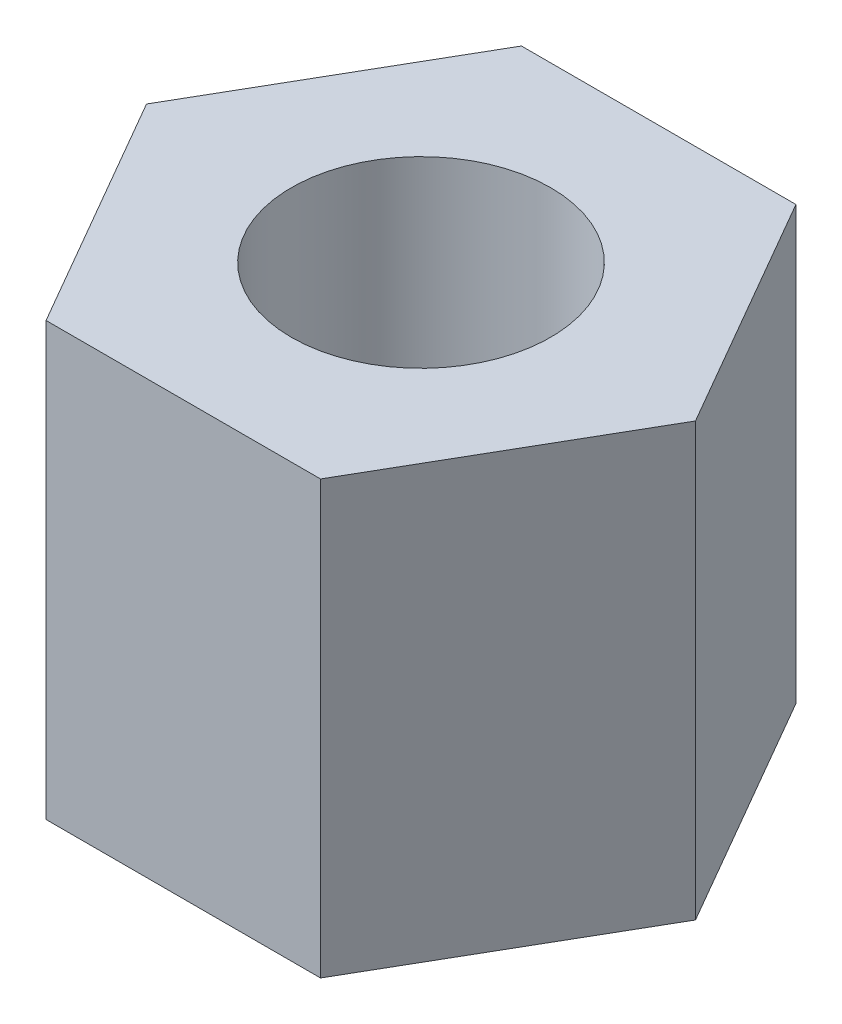
from build123d import *

# Parameters (mm, degrees)
ESQUISSE1_R        = 1.5
BOSS_EXTRU_1_DEPTH = 5


with BuildPart() as part:
    # Esquisse1 → Boss.-Extru.1 (new body)
    with BuildSketch(Plane(origin=(0, 0, 0), x_dir=(1, 0, 0), z_dir=(0, 1, 0))):
        Polygon((1.58771324, 2.75), (-1.58771324, 2.75), (-3.175426481, 0), (-1.58771324, -2.75), (1.58771324, -2.75), (3.175426481, 0), align=None)
        with Locations(Location((0, 0, 0), (0, 0, 270))):
            Circle(ESQUISSE1_R, mode=Mode.SUBTRACT)
    extrude(amount=BOSS_EXTRU_1_DEPTH)


solid = part.part
